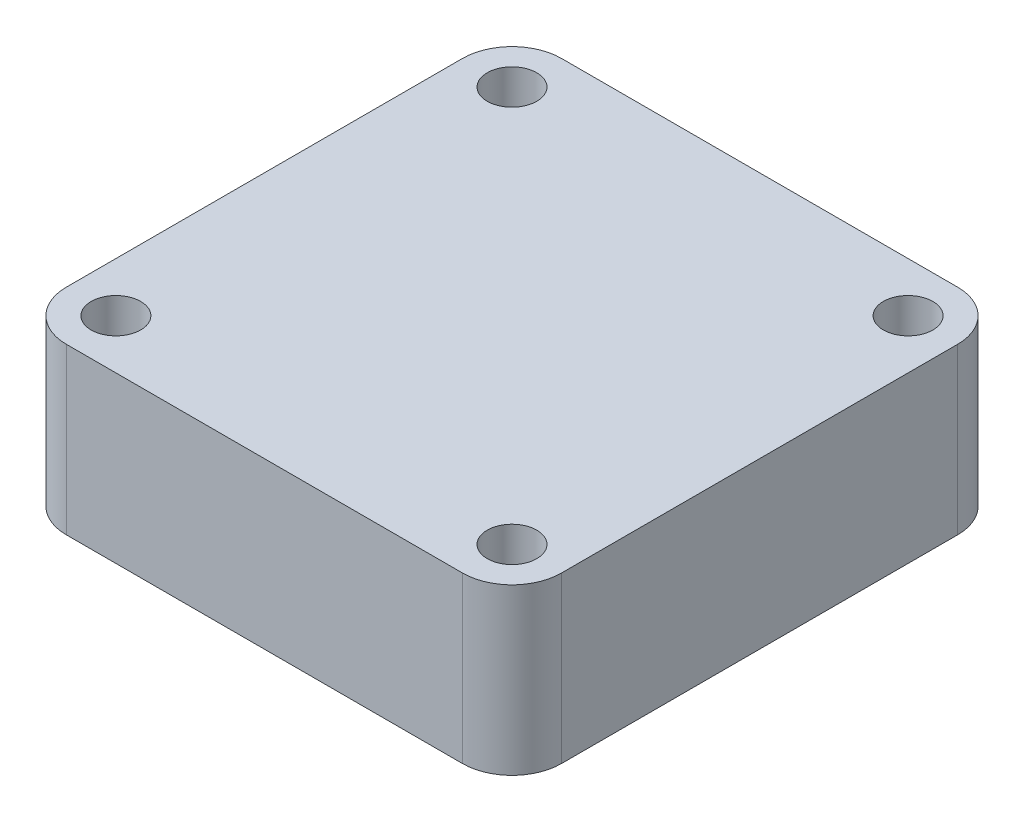
from build123d import *

# Parameters (mm, degrees)
SKETCH1_W           = 30
SKETCH1_H           = 30
BOSS_EXTRUDE1_DEPTH = 10
SKETCH2_R           = 1.5
CUT_EXTRUDE1_DEPTH  = 10
FILLET1_R           = 3


with BuildPart() as part:
    # Sketch1 → Boss-Extrude1 (new body)
    with BuildSketch(Plane(origin=(0, 0, 0), x_dir=(1, 0, 0), z_dir=(0, 1, 0))):
        with Locations((15, -15)):
            Rectangle(SKETCH1_W, SKETCH1_H)
    extrude(amount=BOSS_EXTRUDE1_DEPTH)

    # Sketch2 → Cut-Extrude1 (cut)
    with BuildSketch(Plane(origin=(0, 10, 0), x_dir=(1, 0, 0), z_dir=(0, 1, 0))):
        with Locations(Location((3, -3, 0), (0, 0, 270))):
            Circle(SKETCH2_R)
        with Locations(Location((27, -3, 0), (0, 0, 270))):
            Circle(SKETCH2_R)
        with Locations(Location((27, -27, 0), (0, 0, 270))):
            Circle(SKETCH2_R)
        with Locations(Location((3, -27, 0), (0, 0, 270))):
            Circle(SKETCH2_R)
    extrude(amount=-CUT_EXTRUDE1_DEPTH, mode=Mode.SUBTRACT)

    # Fillet1
    fillet1_edges = [part.edges().sort_by_distance(p)[0] for p in [
        (0, 5, 0),
        (30, 5, 0),
        (30, 5, 30),
        (0, 5, 30),
    ]]
    fillet(fillet1_edges, radius=FILLET1_R)


solid = part.part
